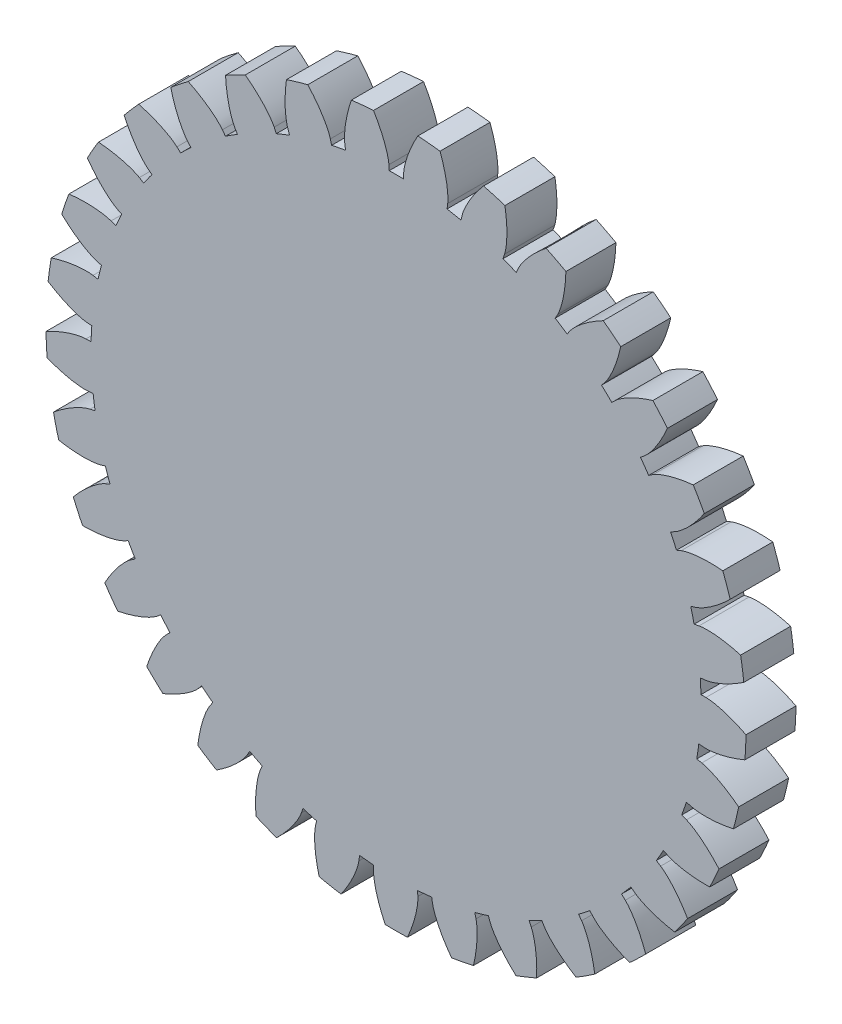
from build123d import *

# Parameters (mm, degrees)
SKETCH_2_R               = 70
EXTRUDE_1_DEPTH          = 10
CUT_EXTRUDE_2_DEPTH      = 100.498743711
PATTERN_CIRCULAR_4_COUNT = 33


with BuildPart() as part:
    # Эскиз2 → Бобышка-Вытянуть1 (new body)
    with BuildSketch(Plane.XY):
        Circle(SKETCH_2_R)
    extrude(amount=EXTRUDE_1_DEPTH)

    # Эскиз2<4> → Вырез-Вытянуть2 (cut, through all)
    with BuildSketch(Plane.XY):
        with BuildLine():
            Line((1.492562386, 60.981737082), (1.527228546, 62.000906204))
            add(Edge.make_bspline(
                [(1.527228546, 62.000906204), (1.528957908, 62.051748643), (1.534408608, 62.153309254), (1.553178908, 62.355934261), (1.604113672, 62.739668435), (1.697165123, 63.25123536), (1.861938624, 63.959985277), (2.106433658, 64.809994757), (2.552190092, 66.118795822), (3.14821783, 67.534453987), (3.714221879, 68.678983682), (4.203463327, 69.571164381), (4.368932838, 69.86352715)],
                knots=[0, 0, 0, 0, 0, 0.001401018, 0.002802036, 0.005604071, 0.010661162, 0.015718253, 0.022839087, 0.029959921, 0.048733673, 0.057988246, 0.057988246, 0.057988246, 0.057988246, 0.057988246], degree=4))
            ThreePointArc((4.368932838, 69.86352715), (-0.065052641, 69.999969773), (-4.498776863, 69.855286176))
            add(Edge.make_bspline(
                [(-1.415558939, 62.003556269), (-1.418601771, 62.054337029), (-1.426675532, 62.155722837), (-1.450676502, 62.35779503), (-1.511512045, 62.740084584), (-1.617754105, 63.24907566), (-1.800790544, 63.953330169), (-2.067172807, 64.796736612), (-2.546606926, 66.093579684), (-3.186863802, 67.51071297), (-3.792187738, 68.656549393), (-4.315320011, 69.551408335), (-4.498776863, 69.855286176)],
                knots=[0, 0, 0, 0, 0, 0.001401018, 0.002802036, 0.005604071, 0.010661162, 0.015718253, 0.022839087, 0.029959921, 0.048733673, 0.058512254, 0.058512254, 0.058512254, 0.058512254, 0.058512254], degree=4))
            Line((-1.415558939, 62.003556269), (-1.354523644, 60.98495934))
            ThreePointArc((-1.354523644, 60.98495934), (0.069038173, 60.999960932), (1.492562386, 60.981737082))
        make_face()
    cut_extrude_2 = extrude(amount=CUT_EXTRUDE_2_DEPTH, mode=Mode.SUBTRACT)

    # Круговой массив4: Вырез-Вытянуть2 ×33 about axis
    pattern_circular_4_axis = Axis((0, 0, 10), (0, 0, -1))
    for i in range(1, PATTERN_CIRCULAR_4_COUNT):
        add(cut_extrude_2.rotate(pattern_circular_4_axis, i * 360 / PATTERN_CIRCULAR_4_COUNT), mode=Mode.SUBTRACT)


solid = part.part
